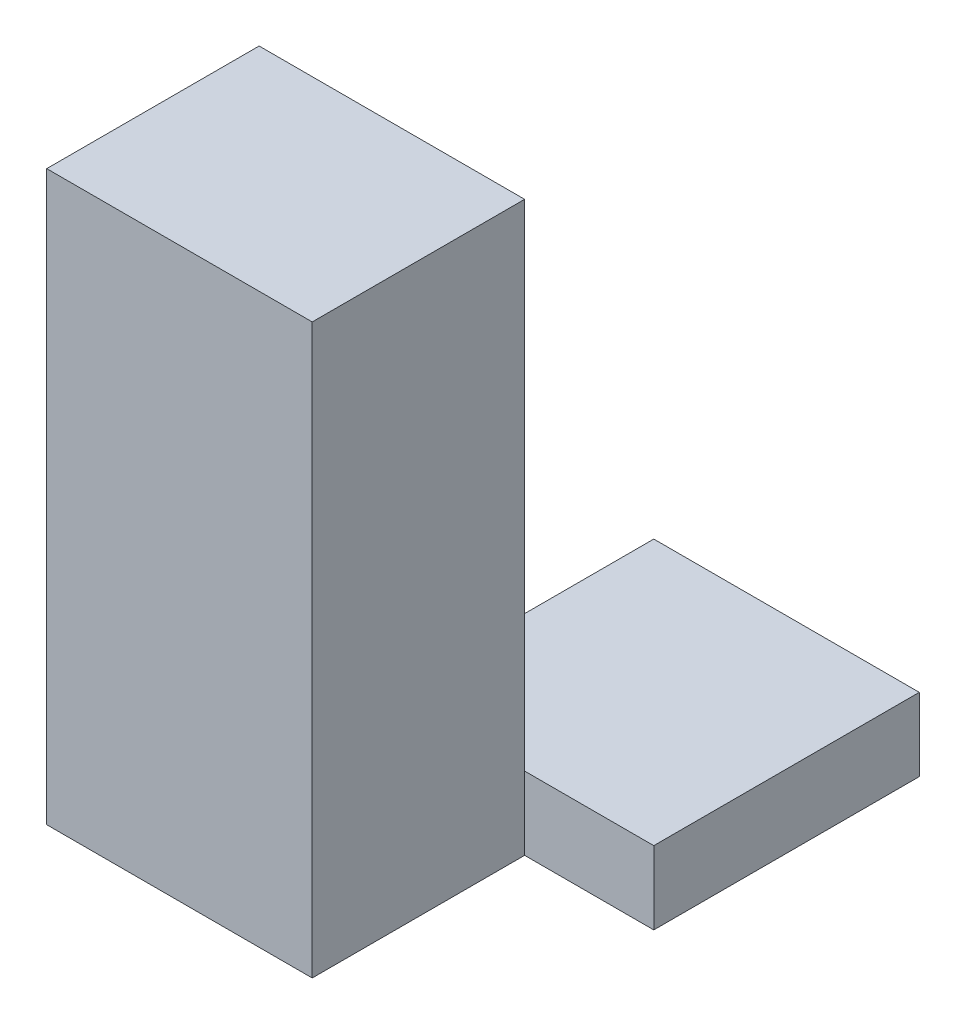
from build123d import *

# Parameters (mm, degrees)
SKETCH1_W           = 40
SKETCH1_H           = 85.6
BOSS_EXTRUDE1_DEPTH = 32
SKETCH4_W           = 40
SKETCH4_H           = 11
BOSS_EXTRUDE2_DEPTH = 40


with BuildPart() as part:
    # Sketch1 → Boss-Extrude1 (new body)
    with BuildSketch(Plane.XY):
        with Locations((0.542986425, -14.926696833)):
            Rectangle(SKETCH1_W, SKETCH1_H)
    extrude(amount=BOSS_EXTRUDE1_DEPTH)

    # Sketch4 → Boss-Extrude2 (add)
    with BuildSketch(Plane(origin=(0, 0, 0), x_dir=(0, 0, -1), z_dir=(1, 0, 0))):
        with Locations((20, -52.226696833)):
            Rectangle(SKETCH4_W, SKETCH4_H)
    extrude(amount=BOSS_EXTRUDE2_DEPTH)


solid = part.part
